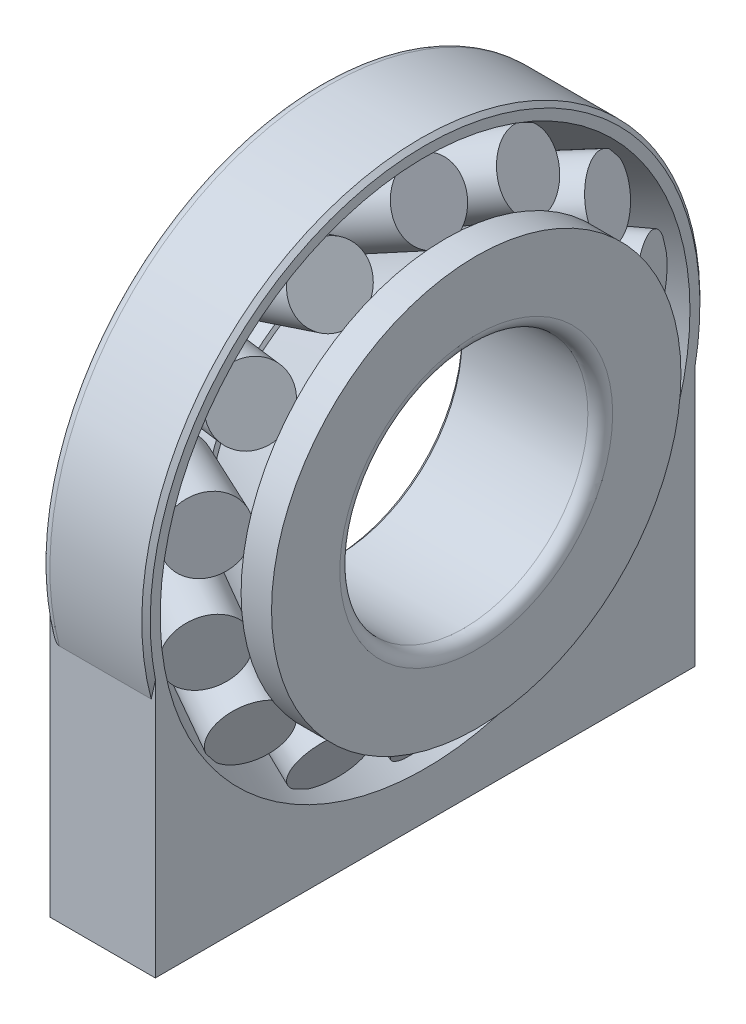
from build123d import *

# Parameters (mm, degrees)
ROLLERSDETAILED_COUNT = 14
ROLLERSDETAILED_ANGLE = 334.285714286
BOSS_EXTRU_1_DEPTH    = 17


with BuildPart() as part:
    # OutRacSke → OuterRace (revolve)
    with BuildSketch(Plane.XY, mode=Mode.PRIVATE) as outerrace_sk:
        with BuildLine():
            Line((-8.25, 42.714564846), (-25.25, 33.492))
            Line((-25.25, 33.492), (-25.25, 43.5))
            ThreePointArc((-25.25, 43.5), (-24.810660172, 44.560660172), (-23.75, 45))
            Line((-23.75, 45), (-8.93, 45))
            Line((-8.93, 45), (-8.25, 44.32))
            Line((-8.25, 44.32), (-8.25, 42.714564846))
        make_face()
    outerrace = revolve(outerrace_sk.sketch.rotate(Axis((-42.5, 0, 0), (1, 0, 0)), 270), axis=Axis((-42.5, 0, 0), (1, 0, 0)))

    # RolDetSke → RollerDetailed (revolve)
    with BuildSketch(Plane.XY):
        Polygon((-21.06770769, 29.533001643), (-23.75, 34.477284499), (-10.30155063, 41.773119581), (-7.619258321, 36.828836725), align=None)
    rollerdetailed = revolve(axis=Axis((-33.419512139, 22.832100613, 0), (0.8789836189464116, 0.47685196615288217, 0)))

    # RollersDetailed: OuterRace, RollerDetailed ×14 about axis
    rollersdetailed_axis = Axis((-50, 0, 0), (1, 0, 0))
    add([outerrace.rotate(rollersdetailed_axis, i * ROLLERSDETAILED_ANGLE / (ROLLERSDETAILED_COUNT - 1)) for i in range(1, ROLLERSDETAILED_COUNT)])
    add([rollerdetailed.rotate(rollersdetailed_axis, i * ROLLERSDETAILED_ANGLE / (ROLLERSDETAILED_COUNT - 1)) for i in range(1, ROLLERSDETAILED_COUNT)])

    # InsRacSke → InnerRace (revolve)
    with BuildSketch(Plane.XY, mode=Mode.PRIVATE) as innerrace_sk:
        with BuildLine():
            Line((-18.663750859, 25.151218783), (-23, 25.151218783))
            Line((-23, 25.151218783), (-23, 20.68))
            Line((-23, 20.68), (-22.32, 20))
            Line((-22.32, 20), (-2, 20))
            ThreePointArc((-2, 20), (-0.585786438, 20.585786438), (0, 22))
            Line((0, 22), (0, 33.009553865))
            Line((0, 33.009553865), (-4.910143093, 33.009553865))
            Line((-4.910143093, 33.009553865), (-4.910143093, 31.884553865))
            Line((-4.910143093, 31.884553865), (-18.358592463, 24.588718783))
            Line((-18.358592463, 24.588718783), (-18.663750859, 25.151218783))
        make_face()
    revolve(innerrace_sk.sketch.rotate(Axis((-42.5, 0, 0), (1, 0, 0)), 270), axis=Axis((-42.5, 0, 0), (1, 0, 0)))

    # Esquisse2 → Boss.-Extru.1 (add)
    with BuildSketch(Plane.ZY.offset(25.25)):
        with BuildLine():
            Line((-43.5, 0), (-43.5, -50.194910994))
            Line((-43.5, -50.194910994), (43.5, -50.194910994))
            Line((43.5, -50.194910994), (43.475308251, -1.465459829))
            ThreePointArc((43.475308251, -1.465459829), (-0.732833916, -43.493826625), (-43.5, 0))
        make_face()
    extrude(amount=-BOSS_EXTRU_1_DEPTH)


solid = part.part
